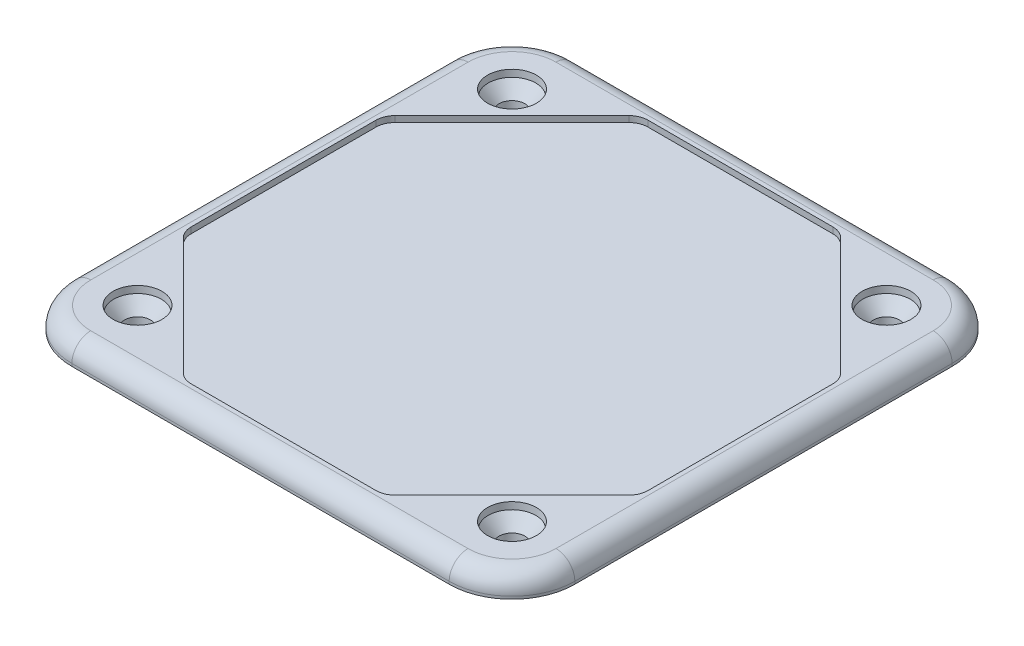
from build123d import *

# Parameters (mm, degrees)
SKETCH1_W           = 63.627
SKETCH1_H           = 63.627
BOSS_EXTRUDE1_DEPTH = 2.7178
CUT_EXTRUDE1_DEPTH  = 0.762
SKETCH3_W           = 58.293
SKETCH3_H           = 58.293
BOSS_EXTRUDE2_DEPTH = 1.6002
SKETCH4_W           = 55.0926
SKETCH4_H           = 55.0926
CUT_EXTRUDE2_DEPTH  = 1.6002
SKETCH5_W           = 3.175
SKETCH5_H           = 1.6002
SKETCH6_W           = 3.175
SKETCH6_H           = 1.6002
SKETCH7_W           = 3.175
SKETCH7_H           = 1.6002
SKETCH8_W           = 3.175
SKETCH8_H           = 1.6002
FILLET1_R           = 7.9502
FILLET2_R           = 2.3876
FILLET3_R           = 3.683
FILLET4_R           = 5.2832


with BuildPart() as part:
    # Sketch1 → Boss-Extrude1 (new body)
    with BuildSketch(Plane(origin=(0, 0, 0), x_dir=(1, 0, 0), z_dir=(0, 1, 0))):
        Rectangle(SKETCH1_W, SKETCH1_H)
    extrude(amount=-BOSS_EXTRUDE1_DEPTH)

    # Sketch2 → Cut-Extrude1 (cut)
    with BuildSketch(Plane(origin=(0, 0, 0), x_dir=(-1, 0, 0), z_dir=(0, 1, 0))):
        Polygon((12.685676302, -28.8925), (28.8925, -12.685676302), (28.8925, 12.685676302), (12.685676302, 28.8925), (-12.685676302, 28.8925), (-28.8925, 12.685676302), (-28.8925, -12.685676302), (-12.685676302, -28.8925), align=None)
    extrude(amount=-CUT_EXTRUDE1_DEPTH, mode=Mode.SUBTRACT)

    # Sketch3 → Boss-Extrude2 (add)
    with BuildSketch(Plane.XZ.offset(2.7178)):
        Rectangle(SKETCH3_W, SKETCH3_H)
    extrude(amount=BOSS_EXTRUDE2_DEPTH)

    # Sketch4 → Cut-Extrude2 (cut)
    with BuildSketch(Plane.XZ.offset(4.318)):
        Rectangle(SKETCH4_W, SKETCH4_H)
    extrude(amount=-CUT_EXTRUDE2_DEPTH, mode=Mode.SUBTRACT)

    # Sketch5 → Revolve1 (revolve)
    with BuildSketch(Plane(origin=(0, 0, -23.6855), x_dir=(-1, 0, 0), z_dir=(0, 0, -1)), mode=Mode.PRIVATE) as revolve1_sk:
        with Locations((22.098, -3.5179)):
            Rectangle(SKETCH5_W, SKETCH5_H)
    revolve(revolve1_sk.sketch.rotate(Axis((-23.6855, -4.318, -23.6855), (0, 1, 0)), 270), axis=Axis((-23.6855, -4.318, -23.6855), (0, 1, 0)))

    # Sketch6 → Revolve2 (revolve)
    with BuildSketch(Plane(origin=(0, 0, 23.6855), x_dir=(-1, 0, 0), z_dir=(0, 0, -1)), mode=Mode.PRIVATE) as revolve2_sk:
        with Locations((-25.273, -3.5179)):
            Rectangle(SKETCH6_W, SKETCH6_H)
    revolve(revolve2_sk.sketch.rotate(Axis((23.6855, -4.318, 23.6855), (0, 1, 0)), 270), axis=Axis((23.6855, -4.318, 23.6855), (0, 1, 0)))

    # Sketch7 → Revolve3 (revolve)
    with BuildSketch(Plane(origin=(0, 0, 23.6855), x_dir=(-1, 0, 0), z_dir=(0, 0, -1)), mode=Mode.PRIVATE) as revolve3_sk:
        with Locations((22.098, -3.5179)):
            Rectangle(SKETCH7_W, SKETCH7_H)
    revolve(revolve3_sk.sketch.rotate(Axis((-23.6855, -4.318, 23.6855), (0, 1, 0)), 270), axis=Axis((-23.6855, -4.318, 23.6855), (0, 1, 0)))

    # Sketch8 → Revolve4 (revolve)
    with BuildSketch(Plane(origin=(0, 0, -23.6855), x_dir=(-1, 0, 0), z_dir=(0, 0, -1)), mode=Mode.PRIVATE) as revolve4_sk:
        with Locations((-25.273, -3.5179)):
            Rectangle(SKETCH8_W, SKETCH8_H)
    revolve(revolve4_sk.sketch.rotate(Axis((23.6855, -4.318, -23.6855), (0, 1, 0)), 270), axis=Axis((23.6855, -4.318, -23.6855), (0, 1, 0)))

    # Sketch9 → Cut-Revolve1 (revolve, cut)
    with BuildSketch(Plane.XY.offset(-23.6855), mode=Mode.PRIVATE) as cut_revolve1_sk:
        Polygon((-20.5994, 0), (-23.6855, 0), (-23.6855, -4.318), (-22.2123, -4.318), (-22.045796889, -2.414860733), (-20.672453944, -0.835010396), align=None)
    revolve(cut_revolve1_sk.sketch.rotate(Axis((-23.6855, 0, -23.6855), (0, -1, 0)), 270), axis=Axis((-23.6855, 0, -23.6855), (0, -1, 0)), mode=Mode.SUBTRACT)

    # Sketch10 → Cut-Revolve2 (revolve, cut)
    with BuildSketch(Plane.XY.offset(23.6855), mode=Mode.PRIVATE) as cut_revolve2_sk:
        Polygon((26.7716, 0), (23.6855, 0), (23.6855, -4.318), (25.1587, -4.318), (25.325203111, -2.414860733), (26.698546056, -0.835010396), align=None)
    revolve(cut_revolve2_sk.sketch.rotate(Axis((23.6855, 0, 23.6855), (0, -1, 0)), 270), axis=Axis((23.6855, 0, 23.6855), (0, -1, 0)), mode=Mode.SUBTRACT)

    # Sketch11 → Cut-Revolve3 (revolve, cut)
    with BuildSketch(Plane.XY.offset(23.6855), mode=Mode.PRIVATE) as cut_revolve3_sk:
        Polygon((-20.5994, 0), (-23.6855, 0), (-23.6855, -4.318), (-22.2123, -4.318), (-22.045796889, -2.414860733), (-20.672453944, -0.835010396), align=None)
    revolve(cut_revolve3_sk.sketch.rotate(Axis((-23.6855, 0, 23.6855), (0, -1, 0)), 270), axis=Axis((-23.6855, 0, 23.6855), (0, -1, 0)), mode=Mode.SUBTRACT)

    # Sketch12 → Cut-Revolve4 (revolve, cut)
    with BuildSketch(Plane.XY.offset(-23.6855), mode=Mode.PRIVATE) as cut_revolve4_sk:
        Polygon((26.7716, 0), (23.6855, 0), (23.6855, -4.318), (25.1587, -4.318), (25.325203111, -2.414860733), (26.698546056, -0.835010396), align=None)
    revolve(cut_revolve4_sk.sketch.rotate(Axis((23.6855, 0, -23.6855), (0, -1, 0)), 270), axis=Axis((23.6855, 0, -23.6855), (0, -1, 0)), mode=Mode.SUBTRACT)

    # Fillet1
    fillet1_edges = [part.edges().sort_by_distance(p)[0] for p in [
        (31.8135, -1.3589, 31.8135),
        (-31.8135, -1.3589, 31.8135),
        (-31.8135, -1.3589, -31.8135),
        (31.8135, -1.3589, -31.8135),
    ]]
    fillet(fillet1_edges, radius=FILLET1_R)

    # Fillet2
    fillet2_edges = [part.edges().sort_by_distance(p)[0] for p in [
        (0, 0, 31.8135),
        (31.8135, 0, 0),
        (0, 0, -31.8135),
        (-31.8135, 0, 0),
        (29.484940332, 0, -29.484940332),
        (-29.484940332, 0, 29.484940332),
        (-29.484940332, 0, -29.484940332),
        (29.484940332, 0, 29.484940332),
        (-12.685676302, -0.381, -28.8925),
        (12.685676302, -0.381, -28.8925),
        (28.8925, -0.381, -12.685676302),
        (28.8925, -0.381, 12.685676302),
        (12.685676302, -0.381, 28.8925),
        (-12.685676302, -0.381, 28.8925),
        (-28.8925, -0.381, 12.685676302),
        (-28.8925, -0.381, -12.685676302),
    ]]
    fillet(fillet2_edges, radius=FILLET2_R)

    # Fillet3
    fillet3_edges = [part.edges().sort_by_distance(p)[0] for p in [
        (-27.5463, -3.5179, -27.5463),
        (-27.5463, -3.5179, 27.5463),
        (27.5463, -3.5179, 27.5463),
        (27.5463, -3.5179, -27.5463),
    ]]
    fillet(fillet3_edges, radius=FILLET3_R)

    # Fillet4
    fillet4_edges = [part.edges().sort_by_distance(p)[0] for p in [
        (29.1465, -3.5179, -29.1465),
        (29.1465, -3.5179, 29.1465),
        (-29.1465, -3.5179, 29.1465),
        (-29.1465, -3.5179, -29.1465),
    ]]
    fillet(fillet4_edges, radius=FILLET4_R)


solid = part.part
